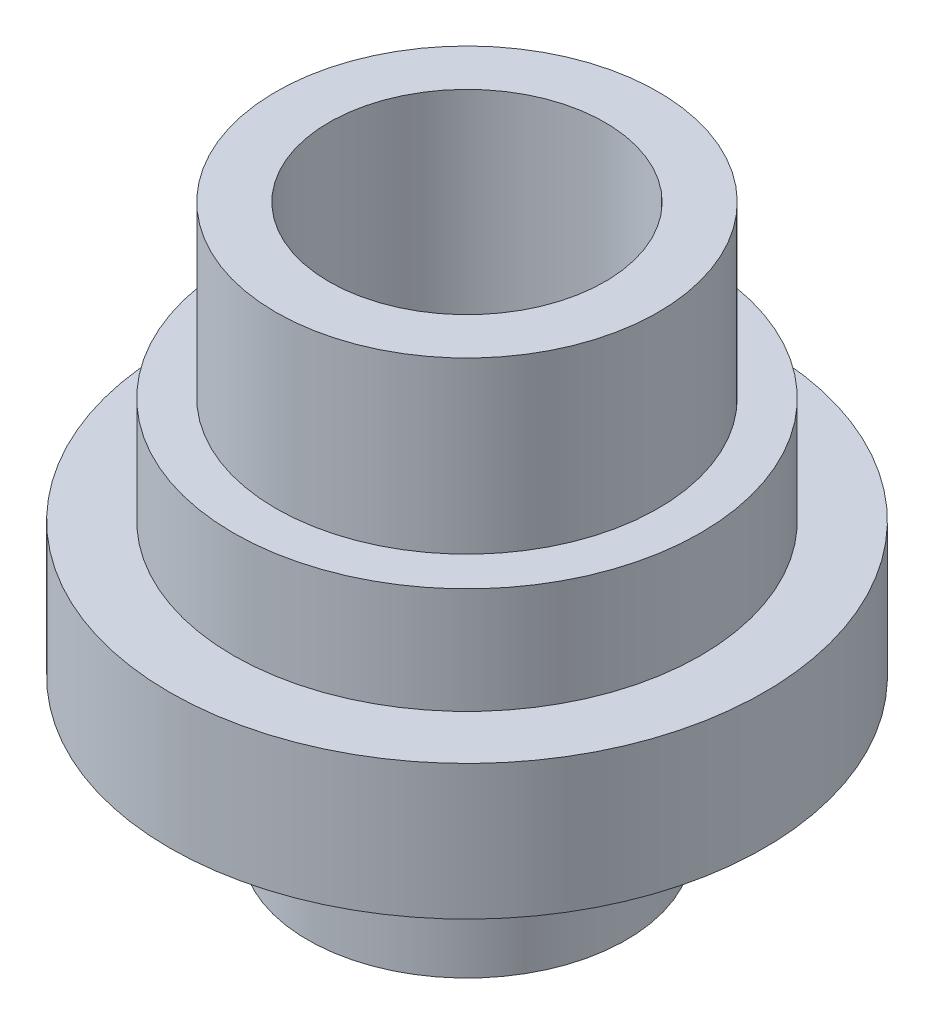
from build123d import *

# Parameters (mm, degrees)
ESQUISSE1_R                  = 11
BOSS_EXTRU_1_DEPTH           = 5
ESQUISSE2_R                  = 9
BOSS_EXTRU_2_DEPTH           = 8
ESQUISSE3_R                  = 14
BOSS_EXTRU_3_DEPTH           = 6.35
ESQUISSE4_R                  = 7.5
BOSS_EXTRU_5_DEPTH           = 7
ENL_V_MAT_EXTRU_1_DEPTH      = 28.684336727
ENL_V_MAT_EXTRU_1_DEPTH_BACK = 28.684336727
ESQUISSE5_R                  = 1.25
ESQUISSE6_R                  = 6.5
ENL_V_MAT_EXTRU_2_DEPTH      = 13
CONG_3_R                     = 2


with BuildPart() as part:
    # Esquisse1 → Boss.-Extru.1 (new body)
    with BuildSketch(Plane(origin=(0, 0, 0), x_dir=(1, 0, 0), z_dir=(0, 1, 0))):
        with Locations(Location((0, 0, 0), (0, 0, 270))):
            Circle(ESQUISSE1_R)
    extrude(amount=BOSS_EXTRU_1_DEPTH)

    # Esquisse2 → Boss.-Extru.2 (add)
    with BuildSketch(Plane(origin=(0, 5, 0), x_dir=(1, 0, 0), z_dir=(0, 1, 0))):
        with Locations(Location((0, 0, 0), (0, 0, 270))):
            Circle(ESQUISSE2_R)
    extrude(amount=BOSS_EXTRU_2_DEPTH)

    # Esquisse3 → Boss.-Extru.3 (add)
    with BuildSketch(Plane.XZ):
        with Locations(Location((0, 0, 0), (0, 0, 270))):
            Circle(ESQUISSE3_R)
    extrude(amount=BOSS_EXTRU_3_DEPTH)

    # Esquisse4 → Boss.-Extru.5 (add)
    with BuildSketch(Plane.XZ.offset(6.35)):
        with Locations(Location((0, 0, 0), (0, 0, 270))):
            Circle(ESQUISSE4_R)
        with BuildLine():
            Line((1.775, -2.034545404), (1.775, 2.034545404))
            ThreePointArc((1.775, 2.034545404), (0, 2.7), (-1.775, 2.034545404))
            Line((-1.775, 2.034545404), (-1.775, -2.034545404))
            ThreePointArc((-1.775, -2.034545404), (0, -2.7), (1.775, -2.034545404))
        make_face(mode=Mode.SUBTRACT)
    extrude(amount=BOSS_EXTRU_5_DEPTH)

    # Esquisse5 → Enlèv. mat.-Extru.1 (cut, two sides: drawn at the far end of the back side and taken through both)
    with BuildSketch(Plane.XZ.offset(6.35).offset(-ENL_V_MAT_EXTRU_1_DEPTH_BACK)):
        with Locations(Location((0, 0, 0), (0, 0, 270))):
            Circle(ESQUISSE5_R)
    extrude(amount=ENL_V_MAT_EXTRU_1_DEPTH + ENL_V_MAT_EXTRU_1_DEPTH_BACK, mode=Mode.SUBTRACT)

    # Esquisse6 → Enlèv. mat.-Extru.2 (cut)
    with BuildSketch(Plane(origin=(0, 13, 0), x_dir=(1, 0, 0), z_dir=(0, 1, 0))):
        with Locations(Location((0, 0, 0), (0, 0, 270))):
            Circle(ESQUISSE6_R)
    extrude(amount=-ENL_V_MAT_EXTRU_2_DEPTH, mode=Mode.SUBTRACT)

    # Congé3
    cong_3_edges = [part.edges().sort_by_distance(p)[0] for p in [
        (0, -6.35, 7.5),
    ]]
    fillet(cong_3_edges, radius=CONG_3_R)


solid = part.part
